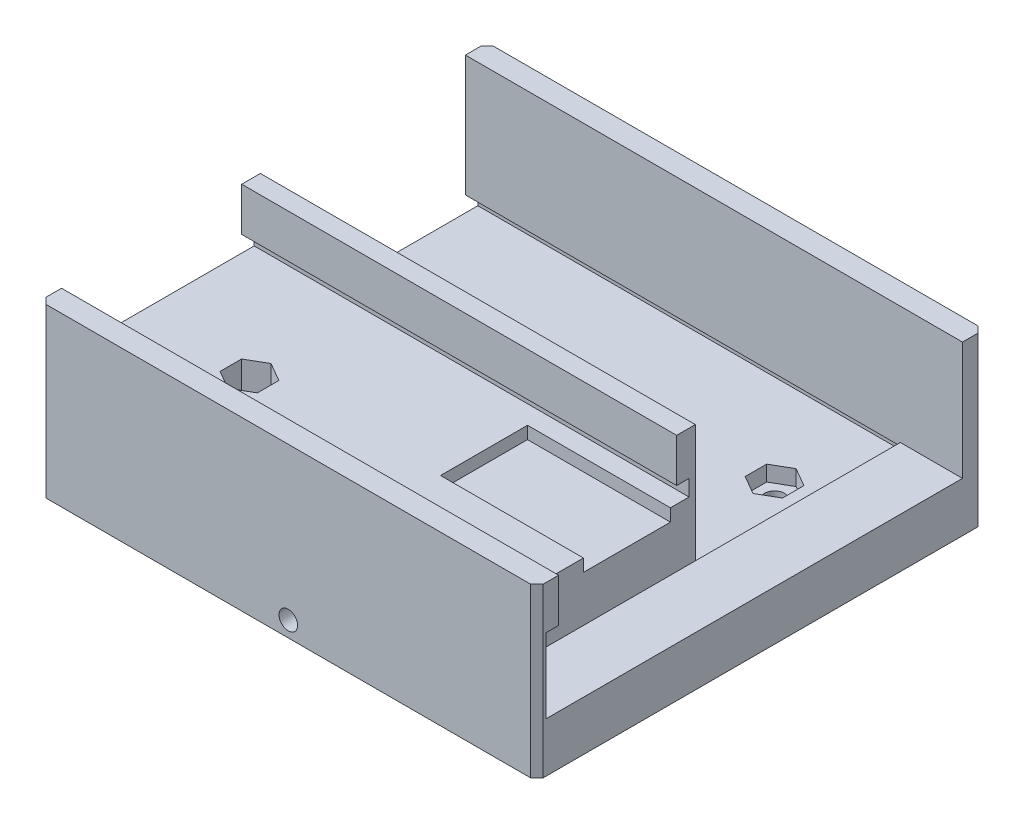
from build123d import *

# Parameters (mm, degrees)
BOSS_EXTRUDE1_DEPTH  = 69.99986
SKETCH2_W            = 23
SKETCH2_H            = 14
CUT_EXTRUDE1_DEPTH   = 2
BOSS_EXTRUDE10_DEPTH = 10
CHAMFER2_SIZE        = 1
SKETCH10_R           = 1.5
CUT_EXTRUDE5_DEPTH   = 90.467972845
SKETCH11_R           = 1.6
CUT_EXTRUDE6_DEPTH   = 78.279501445
CUT_EXTRUDE7_DEPTH   = 14.9


with BuildPart() as part:
    # Sketch1 → Boss-Extrude1 (new body)
    with BuildSketch(Plane.ZY.offset(29.759563114)):
        Polygon((-16.355611523, -2.282836071), (-18.355611523, -2.282836071), (-18.355611523, -4.782836071), (18.644388477, -4.782836071), (18.644388477, -2.282836071), (16.644388477, -2.282836071), (16.644388477, 17.217163929), (19.644388477, 17.217163929), (19.644388477, 10.217163929), (17.644388477, 10.217163929), (17.644388477, 7.617163929), (50.644324477, 7.617163929), (50.644324477, 10.217163929), (48.644324477, 10.217163929), (48.644324477, 17.217163929), (52.144356477, 17.217163929), (52.144356477, -9.782836071), (-19.855643523, -9.782836071), (-19.855643523, 17.217163929), (-16.355611523, 17.217163929), align=None)
    extrude(amount=-BOSS_EXTRUDE1_DEPTH)

    # Sketch2 → Cut-Extrude1 (cut)
    with BuildSketch(Plane(origin=(0, 7.617163929, 0), x_dir=(1, 0, 0), z_dir=(0, 1, 0))):
        with Locations((28.740296886, -27.644388477)):
            Rectangle(SKETCH2_W, SKETCH2_H)
    extrude(amount=-CUT_EXTRUDE1_DEPTH, mode=Mode.SUBTRACT)

    # Sketch9 → Boss-Extrude10 (add)
    with BuildSketch(Plane(origin=(40.240296886, 0, 0), x_dir=(0, 0, -1), z_dir=(1, 0, 0))):
        Polygon((-48.644324477, 17.217163929), (-52.144356477, 17.217163929), (-52.144356477, -9.782836071), (19.855643523, -9.782836071), (19.855643523, 17.217163929), (16.355611523, 17.217163929), (16.355611523, -1.782836071), (-50.644324477, -1.782836071), (-50.644324477, 10.217163929), (-48.644324477, 10.217163929), align=None)
    extrude(amount=BOSS_EXTRUDE10_DEPTH)

    # Chamfer2
    chamfer2_edges = [part.edges().sort_by_distance(p)[0] for p in [
        (-29.759563114, 3.717163929, -19.855643523),
        (-29.759563114, 3.717163929, 52.144356477),
        (50.240296886, 3.717163929, 52.144356477),
        (50.240296886, 3.717163929, -19.855643523),
    ]]
    chamfer(chamfer2_edges, length=CHAMFER2_SIZE)

    # Sketch10 → Cut-Extrude5 (cut, through all)
    with BuildSketch(Plane.XY.offset(52.144356477)):
        with Locations((10.240366886, -7.282836071)):
            Circle(SKETCH10_R)
    extrude(amount=-CUT_EXTRUDE5_DEPTH, mode=Mode.SUBTRACT)

    # Sketch11 → Cut-Extrude6 (cut, through all)
    with BuildSketch(Plane.XZ.offset(9.782836071)):
        with Locations(Location((-12.013114804, 36.144356477, 0), (0, 0, 270))):
            Circle(SKETCH11_R)
        with Locations(Location((32.493848577, -3.855643523, 0), (0, 0, 270))):
            Circle(SKETCH11_R)
    extrude(amount=-CUT_EXTRUDE6_DEPTH, mode=Mode.SUBTRACT)

    # Sketch12 → Cut-Extrude7 (cut)
    with BuildSketch(Plane(origin=(0, 7.617163929, 0), x_dir=(1, 0, 0), z_dir=(0, 1, 0))):
        Polygon((-12.013114804, -32.680254862), (-15.013114804, -34.412305669), (-15.013114804, -37.876407284), (-12.013114804, -39.608458092), (-9.013114804, -37.876407284), (-9.013114804, -34.412305669), align=None)
        Polygon((32.493848577, 7.319745138), (29.493848577, 5.587694331), (29.493848577, 2.123592716), (32.493848577, 0.391541908), (35.493848577, 2.123592716), (35.493848577, 5.587694331), align=None)
    extrude(amount=-CUT_EXTRUDE7_DEPTH, mode=Mode.SUBTRACT)


solid = part.part
